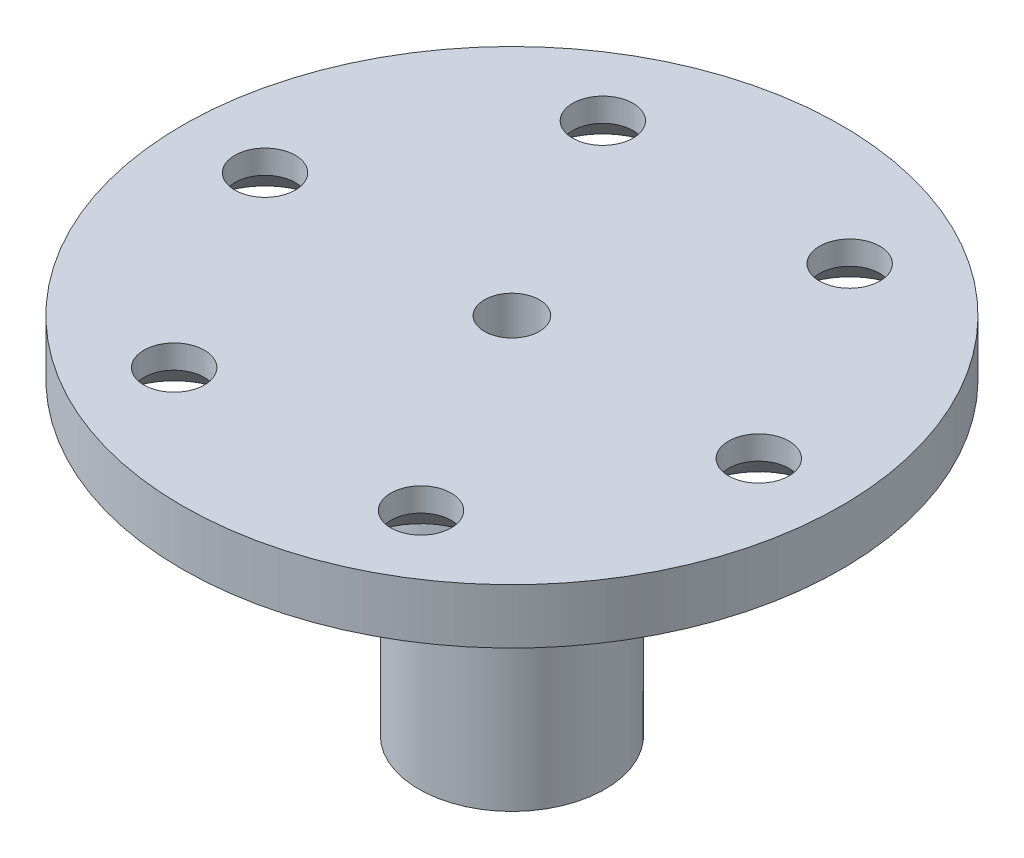
from build123d import *

# Parameters (mm, degrees)
SKETCH_1_R               = 8.475
EXTRUDE_1_DEPTH          = 24.1
CUT_EXTRUDE_2_REACH      = 28.916
SKETCH_3_R               = 5
EXTRUDE_2_DEPTH          = 22
SKETCH_6_R               = 12.5
SKETCH_6_R_2             = 7.5
EXTRUDE_3_DEPTH          = 3
EXTRUDE_START            = 1
SKETCH_20_R              = 8.8
SKETCH_20_R_2            = 8.475
EXTRUDE_4_DEPTH          = 1
HOLE_WIZARD_M3_4_D       = 2.5
HOLE_WIZARD_M3_4_DEPTH   = 8.5
HOLE_WIZARD_M3_4_TIP     = 0.751075774
SKETCH_24_R              = 30
EXTRUDE_5_DEPTH          = 5
SKETCH_25_R              = 2.5
CUT_EXTRUDE_3_DEPTH      = 10
HOLE_WIZARD_1_AT_2_COUNT = 2
HOLE_WIZARD_1_AT_2_PITCH = 22.5
HOLE_WIZARD_1_AT_3_COUNT = 2
HOLE_WIZARD_1_AT_3_PITCH = 38.97114317
HOLE_WIZARD_1_AT_4_COUNT = 2
HOLE_WIZARD_1_AT_4_PITCH = 45
HOLE_WIZARD_1_AT_5_COUNT = 2
HOLE_WIZARD_1_AT_5_PITCH = 38.97114317
HOLE_WIZARD_1_AT_6_COUNT = 2
HOLE_WIZARD_1_AT_6_PITCH = 22.5
EXTRUDE_START_2          = 4
SKETCH_34_R              = 8.475
SKETCH_34_R_2            = 5
EXTRUDE_8_DEPTH          = 4


with BuildPart() as part:
    # 草图1 → 凸台-拉伸1 (new body)
    with BuildSketch(Plane(origin=(0, 0, 0), x_dir=(1, 0, 0), z_dir=(0, 1, 0))):
        with Locations(Location((0, 0, 0), (0, 0, 270))):
            Circle(SKETCH_1_R)
    extrude(amount=EXTRUDE_1_DEPTH)

    # 草图3 → 切除-拉伸2 (cut, up to next)
    with BuildSketch(Plane.XZ, mode=Mode.PRIVATE) as cut_extrude_2_sk1:
        with Locations(Location((0, 0, 0), (0, 0, 270))):
            Circle(SKETCH_3_R)
    cut_extrude_2_tool1 = extrude(cut_extrude_2_sk1.sketch, amount=-CUT_EXTRUDE_2_REACH, mode=Mode.PRIVATE) & part.part
    add(cut_extrude_2_tool1.solids().sort_by_distance((0, 0, 0))[0], mode=Mode.SUBTRACT)

    # 草图4 → 凸台-拉伸2 (add)
    with BuildSketch(Plane.XZ):
        with BuildLine():
            Line((-3.947215931, 3.069118179), (-4.050917396, -2.930881821))
            ThreePointArc((-4.050917396, -2.930881821), (-4.999253362, 0.086404983), (-3.947215931, 3.069118179))
        make_face()
    extrude(amount=-EXTRUDE_2_DEPTH)

    # 草图6 → 凸台-拉伸3 (add)
    with BuildSketch(Plane(origin=(0, 24.1, 0), x_dir=(1, 0, 0), z_dir=(0, 1, 0))):
        with Locations(Location((0, 0, 0), (0, 0, 270))):
            Circle(SKETCH_6_R)
        Circle(SKETCH_6_R_2, mode=Mode.SUBTRACT)
    extrude(amount=-EXTRUDE_3_DEPTH)

    # 草图20 → 凸台-拉伸4 (add)
    with BuildSketch(Plane.XZ.offset(-21.1).offset(EXTRUDE_START)):
        with Locations(Location((0, 0, 0), (0, 0, 90))):
            Circle(SKETCH_20_R)
        with Locations(Location((0, 0, 0), (0, 0, 270))):
            Circle(SKETCH_20_R_2, mode=Mode.SUBTRACT)
    extrude(amount=-EXTRUDE_4_DEPTH)

    # M3 螺纹孔4
    with Locations(Plane(origin=(-3.999066663, 0, 0.069118179), x_dir=(-0.01728099666811417, 0, -0.9998506724277165), z_dir=(0.9998506724277165, 0, -0.01728099666811417))):
        with Locations((0, 10)):
            Hole(HOLE_WIZARD_M3_4_D / 2, depth=HOLE_WIZARD_M3_4_DEPTH)
            with Locations((0, 0, -(HOLE_WIZARD_M3_4_DEPTH + HOLE_WIZARD_M3_4_TIP / 2))):  # 118° drill point
                Cone(0, HOLE_WIZARD_M3_4_D / 2, HOLE_WIZARD_M3_4_TIP, mode=Mode.SUBTRACT)

    # 草图24 → 凸台-拉伸5 (add)
    with BuildSketch(Plane(origin=(0, 24.1, 0), x_dir=(1, 0, 0), z_dir=(0, 1, 0))):
        with Locations(Location((0, 0, 0), (0, 0, 270))):
            Circle(SKETCH_24_R)
    extrude(amount=EXTRUDE_5_DEPTH)

    # 草图25 → 切除-拉伸3 (cut)
    with BuildSketch(Plane(origin=(0, 29.1, 0), x_dir=(1, 0, 0), z_dir=(0, 1, 0))):
        with Locations(Location((0, 0, 0), (0, 0, 270))):
            Circle(SKETCH_25_R)
    extrude(amount=-CUT_EXTRUDE_3_DEPTH, mode=Mode.SUBTRACT)

    # 草图31 → 打孔尺寸(%根据十字)槽半沉头木螺钉的类型1 (revolve, cut)
    with BuildSketch(Plane(origin=(-11.275607113, 24.1, 19.47076486), x_dir=(0, 0, -1), z_dir=(1, 0, 0))):
        Polygon((0, 0), (0, 5), (2.75, 5), (2.75, 2.85), (5.6, 0), align=None)
    hole_wizard_1 = revolve(axis=Axis((-11.275607113, 17.75, 19.47076486), (0, 1, 0)), mode=Mode.SUBTRACT)

    # 打孔尺寸(%根据十字)槽半沉头木螺钉的类型1 at 2: 打孔尺寸(%根据十字)槽半沉头木螺钉的类型1 ×2
    with Locations(*[Vector(0.9999991358386731, 0, 0.0013146565738525046) * (i * HOLE_WIZARD_1_AT_2_PITCH) for i in range(1, HOLE_WIZARD_1_AT_2_COUNT)]):
        add(hole_wizard_1, mode=Mode.SUBTRACT)

    # 打孔尺寸(%根据十字)槽半沉头木螺钉的类型1 at 3: 打孔尺寸(%根据十字)槽半沉头木螺钉的类型1 ×2
    with Locations(*[Vector(0.8666819836857027, 0, -0.49886104192912833) * (i * HOLE_WIZARD_1_AT_3_PITCH) for i in range(1, HOLE_WIZARD_1_AT_3_COUNT)]):
        add(hole_wizard_1, mode=Mode.SUBTRACT)

    # 打孔尺寸(%根据十字)槽半沉头木螺钉的类型1 at 4: 打孔尺寸(%根据十字)槽半沉头木螺钉的类型1 ×2
    with Locations(*[Vector(0.5011380939095448, 0, -0.8653673271118504) * (i * HOLE_WIZARD_1_AT_4_PITCH) for i in range(1, HOLE_WIZARD_1_AT_4_COUNT)]):
        add(hole_wizard_1, mode=Mode.SUBTRACT)

    # 打孔尺寸(%根据十字)槽半沉头木螺钉的类型1 at 5: 打孔尺寸(%根据十字)槽半沉头木螺钉的类型1 ×2
    with Locations(*[Vector(0.0013146565738523764, 0, -0.9999991358386731) * (i * HOLE_WIZARD_1_AT_5_PITCH) for i in range(1, HOLE_WIZARD_1_AT_5_COUNT)]):
        add(hole_wizard_1, mode=Mode.SUBTRACT)

    # 打孔尺寸(%根据十字)槽半沉头木螺钉的类型1 at 6: 打孔尺寸(%根据十字)槽半沉头木螺钉的类型1 ×2
    with Locations(*[Vector(-0.49886104192912806, 0, -0.8666819836857028) * (i * HOLE_WIZARD_1_AT_6_PITCH) for i in range(1, HOLE_WIZARD_1_AT_6_COUNT)]):
        add(hole_wizard_1, mode=Mode.SUBTRACT)

    # 草图34 → 凸台-拉伸8 (add)
    with BuildSketch(Plane(origin=(0, 0, 0), x_dir=(-1, 0, 0), z_dir=(0, -1, 0)).offset(EXTRUDE_START_2)):
        with Locations(Location((0, 0, 0), (0, 0, 90))):
            Circle(SKETCH_34_R)
        with Locations(Location((0, 0, 0), (0, 0, 90))):
            Circle(SKETCH_34_R_2, mode=Mode.SUBTRACT)
    extrude(amount=-EXTRUDE_8_DEPTH)


solid = part.part
